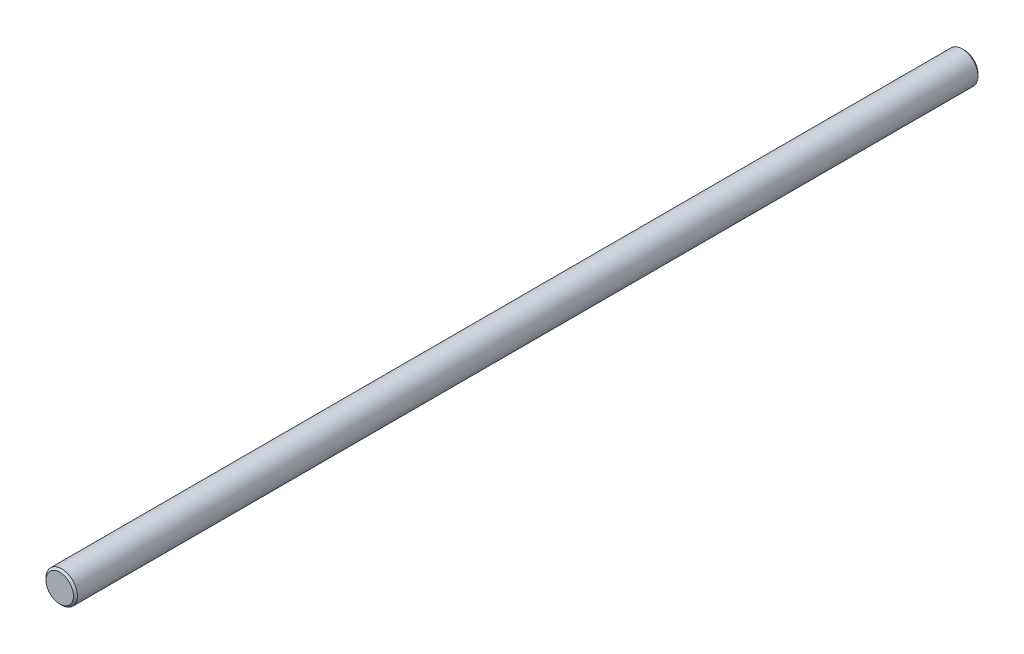
from build123d import *

# Parameters (mm, degrees)
ESQUISSE1_R        = 4
BOSS_EXTRU_1_DEPTH = 115
CHANFREIN1_SIZE    = 0.5


with BuildPart() as part:
    # Esquisse1 → Boss.-Extru.1 (new, symmetric)
    with BuildSketch(Plane.XY):
        Circle(ESQUISSE1_R)
    extrude(amount=BOSS_EXTRU_1_DEPTH, both=True)

    # Chanfrein1
    chanfrein1_edges = [part.edges().sort_by_distance(p)[0] for p in [
        (-4, 0, -115),
        (-4, 0, 115),
    ]]
    chamfer(chanfrein1_edges, length=CHANFREIN1_SIZE)


solid = part.part
